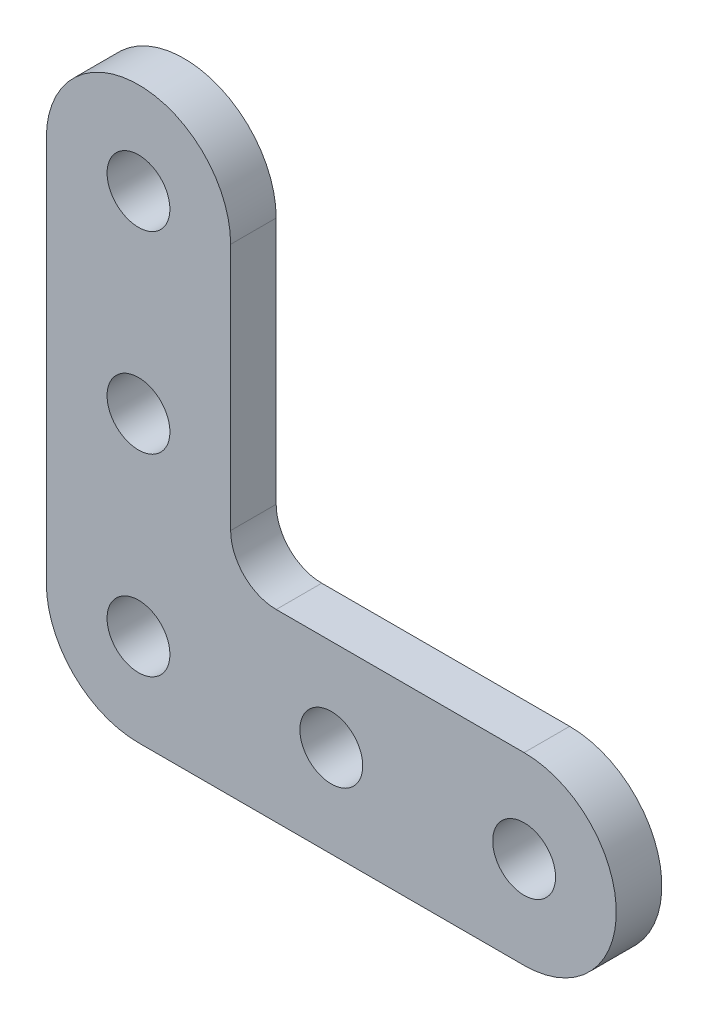
from build123d import *

# Parameters (mm, degrees)
SKETCH1_R           = 2.07
SKETCH1_R_2         = 6.07
BOSS_EXTRUDE1_DEPTH = 1.5
FILLET1_R           = 3


with BuildPart() as part:
    # Sketch1 → Boss-Extrude1 (new, symmetric)
    # profile 1 of 5: a face of its own
    with BuildSketch(Plane.XY):
        with BuildLine():
            ThreePointArc((6.07, 25.4), (0, 19.33), (-6.07, 25.4))
            Line((-6.07, 25.4), (-6.07, 0))
            ThreePointArc((-6.07, 0), (0, 6.07), (6.07, 0))
            Line((6.07, 0), (6.07, 6.07))
            Line((6.07, 6.07), (6.07, 25.4))
        make_face()
        with Locations((0, 12.7)):
            Circle(SKETCH1_R, mode=Mode.SUBTRACT)
    # profile 2 of 5: a face of its own
    with BuildSketch(Plane.XY):
        with Locations((0, 25.4)):
            Circle(SKETCH1_R_2)
        with Locations((0, 25.4)):
            Circle(SKETCH1_R, mode=Mode.SUBTRACT)
    # profile 3 of 5: a face of its own
    with BuildSketch(Plane.XY):
        Circle(SKETCH1_R_2)
        Circle(SKETCH1_R, mode=Mode.SUBTRACT)
    # profile 4 of 5: a face of its own
    with BuildSketch(Plane.XY):
        with BuildLine():
            Line((6.07, 6.07), (6.07, 0))
            ThreePointArc((6.07, 0), (4.292138162, -4.292138162), (0, -6.07))
            Line((0, -6.07), (25.4, -6.07))
            ThreePointArc((25.4, -6.07), (19.33, 0), (25.4, 6.07))
            Line((25.4, 6.07), (6.07, 6.07))
        make_face()
        with Locations((12.7, 0)):
            Circle(SKETCH1_R, mode=Mode.SUBTRACT)
    # profile 5 of 5: a face of its own
    with BuildSketch(Plane.XY):
        with Locations((25.4, 0)):
            Circle(SKETCH1_R_2)
        with Locations((25.4, 0)):
            Circle(SKETCH1_R, mode=Mode.SUBTRACT)
    extrude(amount=BOSS_EXTRUDE1_DEPTH, both=True)

    # Fillet1
    fillet1_edges = [part.edges().sort_by_distance(p)[0] for p in [
        (6.07, 6.07, 0),
    ]]
    fillet(fillet1_edges, radius=FILLET1_R)


solid = part.part
